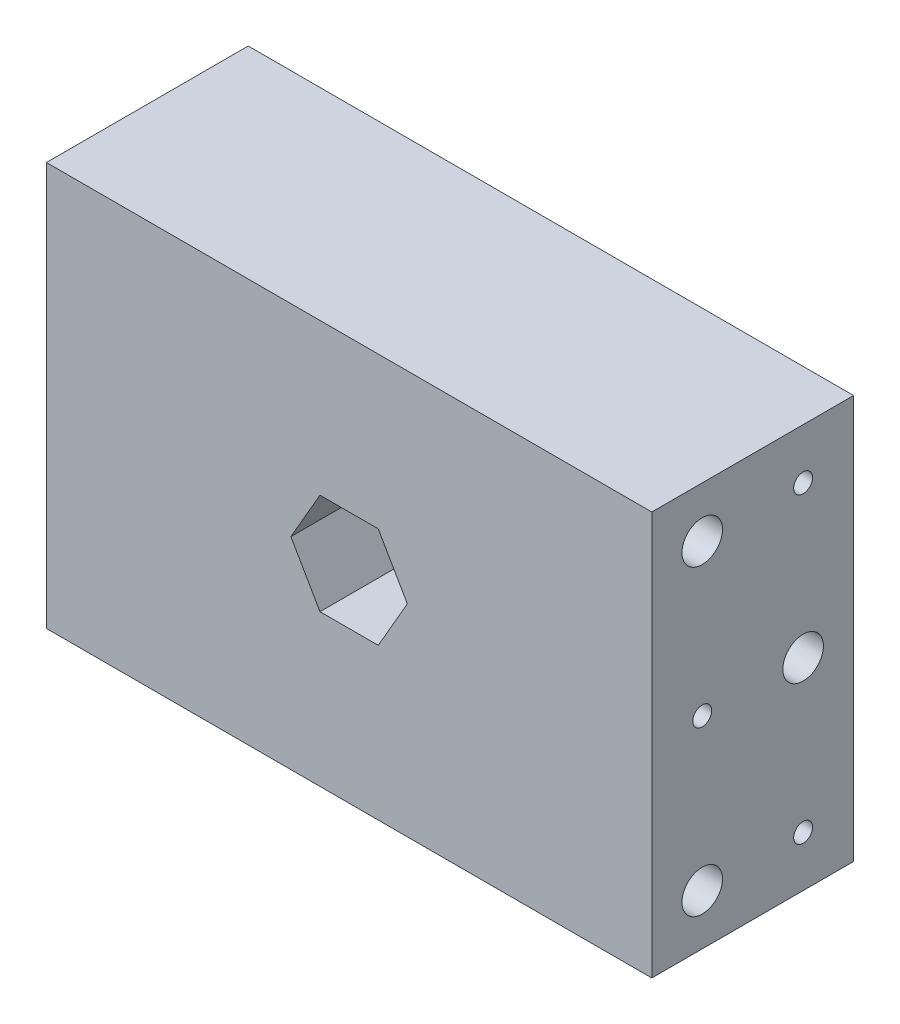
from build123d import *

# Parameters (mm, degrees)
SKETCH2_W                             = 76.2
SKETCH2_H                             = 50.8
BOSS_EXTRUDE1_DEPTH                   = 25.4
TAP_DRILL_FOR_1_4_20_TAP1_AT_2_COUNT  = 2
TAP_DRILL_FOR_1_4_20_TAP1_AT_2_PITCH  = 22.895250599
TAP_DRILL_FOR_1_4_20_TAP1_AT_3_COUNT  = 2
TAP_DRILL_FOR_1_4_20_TAP1_AT_3_PITCH  = 38.1
F_3_32_0_09375_DOWEL_HOLE1_AT_2_COUNT = 2
F_3_32_0_09375_DOWEL_HOLE1_AT_2_PITCH = 38.1
F_3_32_0_09375_DOWEL_HOLE1_AT_3_COUNT = 2
F_3_32_0_09375_DOWEL_HOLE1_AT_3_PITCH = 22.895250599
CUT_EXTRUDE1_DEPTH                    = 53.363441445


with BuildPart() as part:
    # Sketch2 → Boss-Extrude1 (new body)
    with BuildSketch(Plane.XY):
        Rectangle(SKETCH2_W, SKETCH2_H)
    extrude(amount=BOSS_EXTRUDE1_DEPTH)

    # Sketch6 → Tap Drill for 1/4-20 Tap1 (revolve, cut)
    with BuildSketch(Plane(origin=(-38.1, 19.05, 19.05), x_dir=(0, 0, 1), z_dir=(0, 1, 0))):
        Polygon((0, 0), (0, 20.583816902), (2.5527, 19.05), (2.5527, 0), align=None)
    tap_drill_for_1_4_20_tap1 = revolve(axis=Axis((-44.45, 19.05, 19.05), (1, 0, 0)), mode=Mode.SUBTRACT)

    # Tap Drill for 1/4-20 Tap1 at 2: Tap Drill for 1/4-20 Tap1 ×2
    with Locations(*[Vector(2.831898447985745e-15, -0.8320502943378457, -0.554700196225226) * (i * TAP_DRILL_FOR_1_4_20_TAP1_AT_2_PITCH) for i in range(1, TAP_DRILL_FOR_1_4_20_TAP1_AT_2_COUNT)]):
        add(tap_drill_for_1_4_20_tap1, mode=Mode.SUBTRACT)

    # Tap Drill for 1/4-20 Tap1 at 3: Tap Drill for 1/4-20 Tap1 ×2
    with Locations(*[(0, -i * TAP_DRILL_FOR_1_4_20_TAP1_AT_3_PITCH, 0) for i in range(1, TAP_DRILL_FOR_1_4_20_TAP1_AT_3_COUNT)]):
        add(tap_drill_for_1_4_20_tap1, mode=Mode.SUBTRACT)

    # Sketch8 → 3/32 (0.09375) Dowel Hole1 (revolve, cut)
    with BuildSketch(Plane(origin=(-38.1, 19.05, 6.35), x_dir=(0, 0, 1), z_dir=(0, 1, 0))):
        Polygon((0, 0), (0, 8.652899675), (1.190625, 7.9375), (1.190625, 0), align=None)
    f_3_32_0_09375_dowel_hole1 = revolve(axis=Axis((-44.45, 19.05, 6.35), (1, 0, 0)), mode=Mode.SUBTRACT)

    # 3/32 (0.09375) Dowel Hole1 at 2: 3/32 (0.09375) Dowel Hole1 ×2
    with Locations(*[(0, -i * F_3_32_0_09375_DOWEL_HOLE1_AT_2_PITCH, 0) for i in range(1, F_3_32_0_09375_DOWEL_HOLE1_AT_2_COUNT)]):
        add(f_3_32_0_09375_dowel_hole1, mode=Mode.SUBTRACT)

    # 3/32 (0.09375) Dowel Hole1 at 3: 3/32 (0.09375) Dowel Hole1 ×2
    with Locations(*[Vector(2.831898447985753e-15, -0.8320502943378447, 0.5547001962252276) * (i * F_3_32_0_09375_DOWEL_HOLE1_AT_3_PITCH) for i in range(1, F_3_32_0_09375_DOWEL_HOLE1_AT_3_COUNT)]):
        add(f_3_32_0_09375_dowel_hole1, mode=Mode.SUBTRACT)

    # Mirror1: Tap Drill for 1/4-20 Tap1, 3/32 (0.09375) Dowel Hole1 across plane
    add(tap_drill_for_1_4_20_tap1.mirror(Plane(origin=(0, 0, 0), x_dir=(0, 0, 1), z_dir=(1, 0, 0))), mode=Mode.SUBTRACT)
    add(f_3_32_0_09375_dowel_hole1.mirror(Plane(origin=(0, 0, 0), x_dir=(0, 0, 1), z_dir=(1, 0, 0))), mode=Mode.SUBTRACT)

    # Mirror1 copy 1 sketch → Mirror1 copy 1 (revolve, cut)
    with BuildSketch(Plane(origin=(38.1, 0, 6.35), x_dir=(0, 0, 1), z_dir=(0, 1, 0))):
        Polygon((0, 0), (0, -20.583816902), (2.5527, -19.05), (2.5527, 0), align=None)
    revolve(axis=Axis((44.45, 0, 6.35), (1, 0, 0)), mode=Mode.SUBTRACT)

    # Mirror1 copy 2 sketch → Mirror1 copy 2 (revolve, cut)
    with BuildSketch(Plane(origin=(38.1, -19.05, 19.05), x_dir=(0, 0, 1), z_dir=(0, 1, 0))):
        Polygon((0, 0), (0, -20.583816902), (2.5527, -19.05), (2.5527, 0), align=None)
    revolve(axis=Axis((44.45, -19.05, 19.05), (1, 0, 0)), mode=Mode.SUBTRACT)

    # Mirror1 copy 3 sketch → Mirror1 copy 3 (revolve, cut)
    with BuildSketch(Plane(origin=(38.1, -19.05, 6.35), x_dir=(0, 0, 1), z_dir=(0, 1, 0))):
        Polygon((0, 0), (0, -8.652899675), (1.190625, -7.9375), (1.190625, 0), align=None)
    revolve(axis=Axis((44.45, -19.05, 6.35), (1, 0, 0)), mode=Mode.SUBTRACT)

    # Mirror1 copy 4 sketch → Mirror1 copy 4 (revolve, cut)
    with BuildSketch(Plane(origin=(38.1, 0, 19.05), x_dir=(0, 0, 1), z_dir=(0, 1, 0))):
        Polygon((0, 0), (0, -8.652899675), (1.190625, -7.9375), (1.190625, 0), align=None)
    revolve(axis=Axis((44.45, 0, 19.05), (1, 0, 0)), mode=Mode.SUBTRACT)

    # Sketch4 → Cut-Extrude1 (cut, through all)
    with BuildSketch(Plane(origin=(0, 0, 0), x_dir=(-1, 0, 0), z_dir=(0, 0, -1))):
        Polygon((3.666174209, 6.35), (-3.666174209, 6.35), (-7.332348419, 0), (-3.666174209, -6.35), (3.666174209, -6.35), (7.332348419, 0), align=None)
    extrude(amount=-CUT_EXTRUDE1_DEPTH, mode=Mode.SUBTRACT)


solid = part.part
